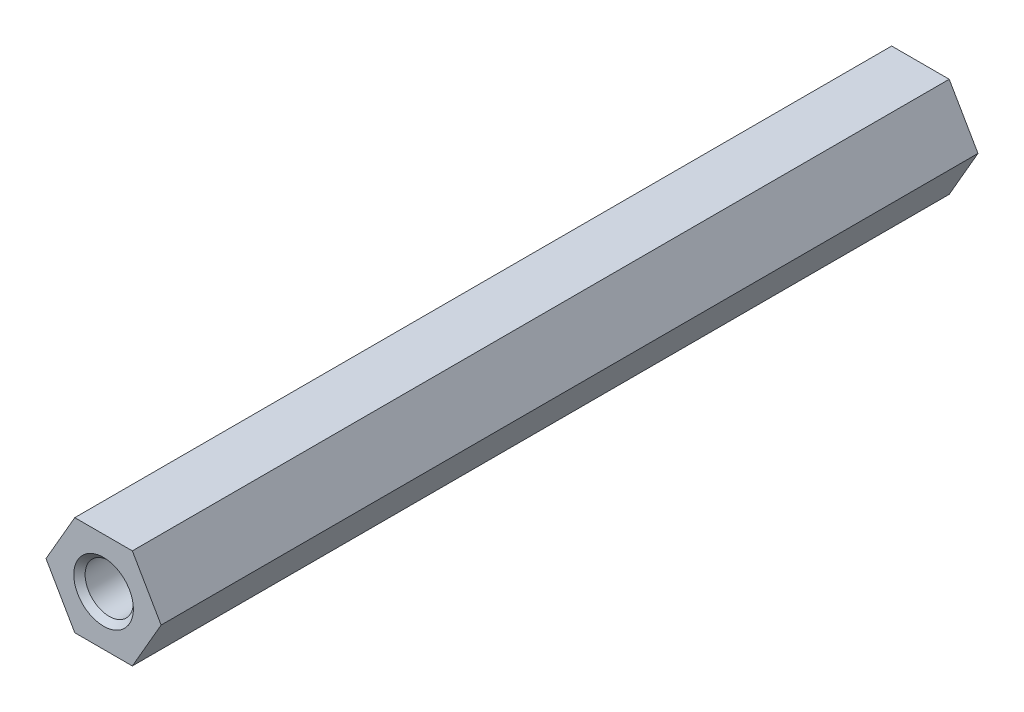
from build123d import *

# Parameters (mm, degrees)
EXTRUDE1_DEPTH        = 50.8
F_6_32_TAPPED_HOLE8_D = 2.7051
CHAMFER1_SIZE         = 0.5
CHAMFER2_SIZE         = 0.5
SKETCH15_R            = 1.5
CUT_EXTRUDE1_DEPTH    = 52.020224748


with BuildPart() as part:
    # Sketch1 → Extrude1 (new body)
    with BuildSketch(Plane.XY):
        Polygon((3.579571669, 0), (1.789785834, 3.1), (-1.789785834, 3.1), (-3.579571669, 0), (-1.789785834, -3.1), (1.789785834, -3.1), align=None)
    extrude(amount=-EXTRUDE1_DEPTH)

    # #6-32 Tapped Hole8 (through all)
    with Locations(Plane(origin=(0.000428254, 0.000741758, 0), x_dir=(1, 0, 0), z_dir=(0, 0, 1))):
        with Locations((0, 0)):
            Hole(F_6_32_TAPPED_HOLE8_D / 2)

    # Chamfer1
    chamfer1_edges = [part.edges().sort_by_distance(p)[0] for p in [
        (1.352978254, 0.000741758, 0),
    ]]
    chamfer(chamfer1_edges, length=CHAMFER1_SIZE)

    # Chamfer2
    chamfer2_edges = [part.edges().sort_by_distance(p)[0] for p in [
        (1.352978254, 0.000741758, -50.8),
    ]]
    chamfer(chamfer2_edges, length=CHAMFER2_SIZE)

    # Sketch15 → Cut-Extrude1 (cut, through all)
    with BuildSketch(Plane.XY):
        with Locations(Location((0, 0, 0), (0, 0, 220.601941258))):
            Circle(SKETCH15_R)
    extrude(amount=-CUT_EXTRUDE1_DEPTH, mode=Mode.SUBTRACT)


solid = part.part
